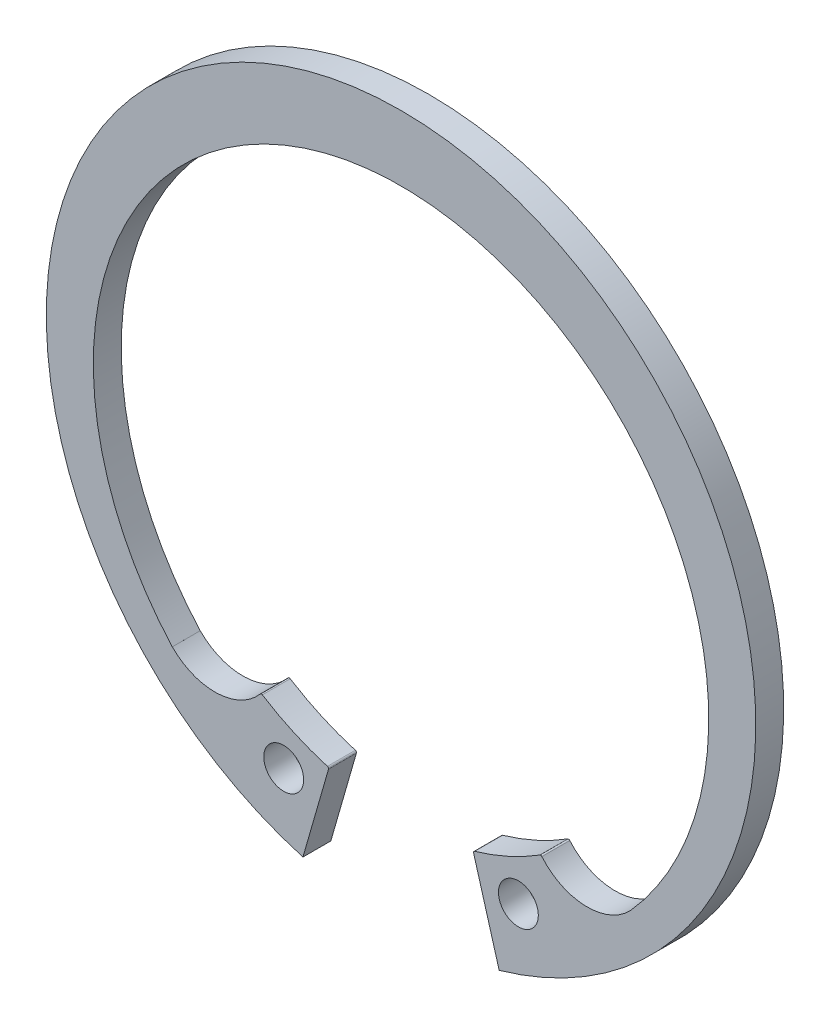
from build123d import *

# Parameters (mm, degrees)
BODYSKE_R    = 1.25
BODY_DEPTH   = 1.75
MODLUGSKE_R  = 1.25
MODLUG_DEPTH = 1.75


with BuildPart() as part:
    # BodySke → Body (new body)
    with BuildSketch(Plane.XY):
        with BuildLine():
            Line((6.15473831, -21.381807602), (5.12564003, -17.806678924))
            ThreePointArc((5.12564003, -17.806678924), (6.26268227, -15.113739212), (9.13415023, -15.660969609))
            ThreePointArc((9.13415023, -15.660969609), (10.710697658, -16.474976548), (12.402371606, -15.939861288))
            ThreePointArc((12.402371606, -15.939861288), (0, 18.15), (-12.402371606, -15.939861288))
            ThreePointArc((-12.402371606, -15.939861288), (-10.710697658, -16.474976548), (-9.13415023, -15.660969609))
            ThreePointArc((-9.13415023, -15.660969609), (-6.26268227, -15.113739212), (-5.12564003, -17.806678924))
            Line((-5.12564003, -17.806678924), (-6.15473831, -21.381807602))
            ThreePointArc((-6.15473831, -21.381807602), (0, 22.25), (6.15473831, -21.381807602))
        make_face()
        with Locations((7.359918802, -17.163543347)):
            Circle(BODYSKE_R, mode=Mode.SUBTRACT)
        with Locations((-7.359918802, -17.163543347)):
            Circle(BODYSKE_R, mode=Mode.SUBTRACT)
    extrude(amount=-BODY_DEPTH)

    # ModLugSke → ModLug (add, through all)
    # profile 1 of 2: a face of its own
    with BuildSketch(Plane.XY):
        with BuildLine():
            Line((6.15473831, -21.381807602), (4.550273009, -15.80783083))
            ThreePointArc((4.550273009, -15.80783083), (4.558712973, -15.732043553), (4.618125604, -15.684241005))
            ThreePointArc((4.618125604, -15.684241005), (6.723383791, -14.903644199), (8.701845472, -13.841979099))
            ThreePointArc((8.701845472, -13.841979099), (8.770273624, -13.827802373), (8.831276161, -13.861891696))
            ThreePointArc((8.831276161, -13.861891696), (11.5450024, -15.176170025), (14.345137247, -14.057741457))
            Line((14.345137247, -14.057741457), (15.89150871, -15.573132342))
            ThreePointArc((15.89150871, -15.573132342), (11.399317041, -19.108062984), (6.15473831, -21.381807602))
        make_face()
        with Locations((7.359918802, -17.163543347)):
            Circle(MODLUGSKE_R, mode=Mode.SUBTRACT)
    # profile 2 of 2: a face of its own
    with BuildSketch(Plane.XY):
        with BuildLine():
            Line((-6.15473831, -21.381807602), (-4.550273009, -15.80783083))
            ThreePointArc((-4.550273009, -15.80783083), (-4.558712973, -15.732043553), (-4.618125604, -15.684241005))
            ThreePointArc((-4.618125604, -15.684241005), (-6.723383791, -14.903644199), (-8.701845472, -13.841979099))
            ThreePointArc((-8.701845472, -13.841979099), (-8.770273624, -13.827802373), (-8.831276161, -13.861891696))
            ThreePointArc((-8.831276161, -13.861891696), (-11.5450024, -15.176170025), (-14.345137247, -14.057741457))
            Line((-14.345137247, -14.057741457), (-15.89150871, -15.573132342))
            ThreePointArc((-15.89150871, -15.573132342), (-11.399317041, -19.108062984), (-6.15473831, -21.381807602))
        make_face()
        with Locations((-7.359918802, -17.163543347)):
            Circle(MODLUGSKE_R, mode=Mode.SUBTRACT)
    extrude(amount=-MODLUG_DEPTH)


solid = part.part
